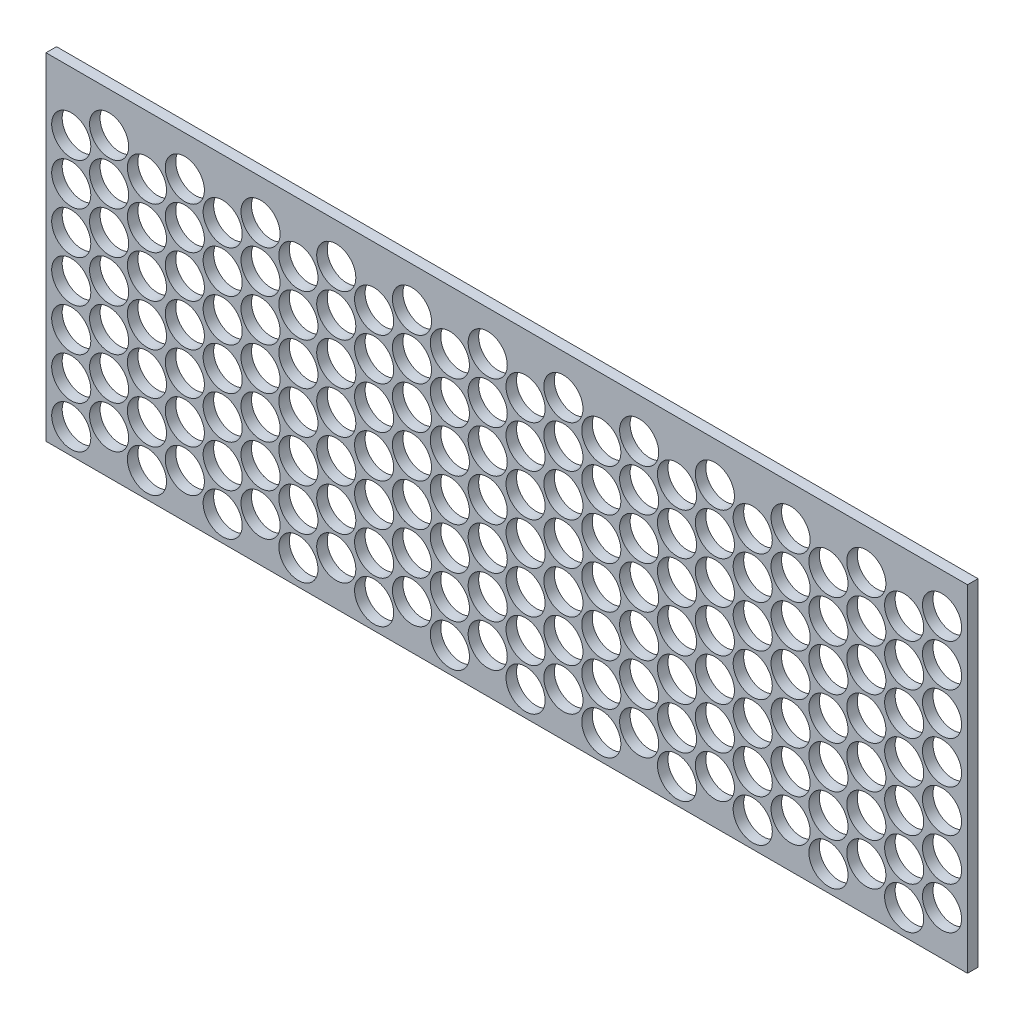
from build123d import *

# Parameters (mm, degrees)
SKETCH1_W            = 438.1
SKETCH1_H            = 160
BOSS_EXTRUDE1_DEPTH  = 5
SKETCH2_R            = 9.3
CUT_EXTRUDE1_DEPTH   = 5
LPATTERN1_COUNT      = 12
LPATTERN1_PITCH      = 36
LPATTERN1_COUNT_DIR2 = 7
LPATTERN1_PITCH_DIR2 = 20


with BuildPart() as part:
    # Sketch1 → Boss-Extrude1 (new body)
    with BuildSketch(Plane.XY):
        with Locations((219.05, 80)):
            Rectangle(SKETCH1_W, SKETCH1_H)
    extrude(amount=BOSS_EXTRUDE1_DEPTH)

    # Sketch2 → Cut-Extrude1 (cut)
    with BuildSketch(Plane.XY.offset(5)):
        with Locations((12, 12)):
            Circle(SKETCH2_R)
        with Locations((30, 21)):
            Circle(SKETCH2_R)
    cut_extrude1 = extrude(amount=-CUT_EXTRUDE1_DEPTH, mode=Mode.SUBTRACT)

    # LPattern1: Cut-Extrude1 12 × 7
    with Locations(*[(i * LPATTERN1_PITCH, j * LPATTERN1_PITCH_DIR2, 0) for i in range(LPATTERN1_COUNT) for j in range(LPATTERN1_COUNT_DIR2) if (i, j) != (0, 0)]):
        add(cut_extrude1, mode=Mode.SUBTRACT)


solid = part.part
